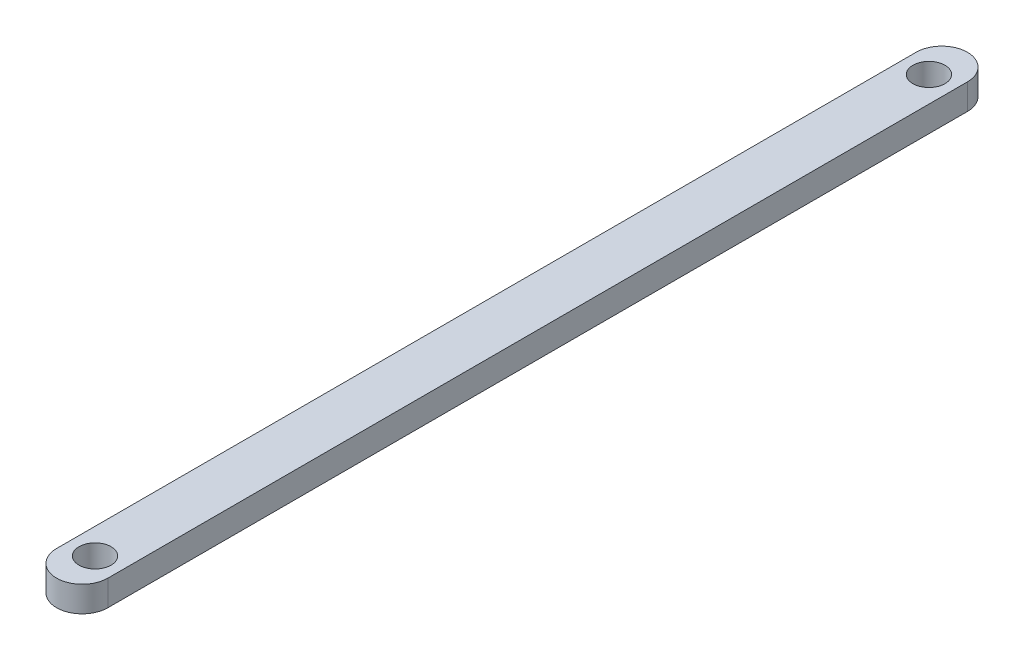
from build123d import *

# Parameters (mm, degrees)
SKETCH1_R           = 1.25
BOSS_EXTRUDE1_DEPTH = 1


with BuildPart() as part:
    # Sketch1 → Boss-Extrude1 (new, symmetric)
    with BuildSketch(Plane(origin=(0, 0, 0), x_dir=(1, 0, 0), z_dir=(0, 1, 0))):
        with BuildLine():
            Line((-1.5, 33.5), (-1.5, -33.5))
            ThreePointArc((-1.5, -33.5), (0.5, -35.5), (2.5, -33.5))
            Line((2.5, -33.5), (2.5, 33.5))
            ThreePointArc((2.5, 33.5), (0.5, 35.5), (-1.5, 33.5))
        make_face()
        with Locations(Location((0.5, 32.5, 0), (0, 0, 270))):
            Circle(SKETCH1_R, mode=Mode.SUBTRACT)
        with Locations(Location((0.5, -32.5, 0), (0, 0, 270))):
            Circle(SKETCH1_R, mode=Mode.SUBTRACT)
    extrude(amount=BOSS_EXTRUDE1_DEPTH, both=True)


solid = part.part
